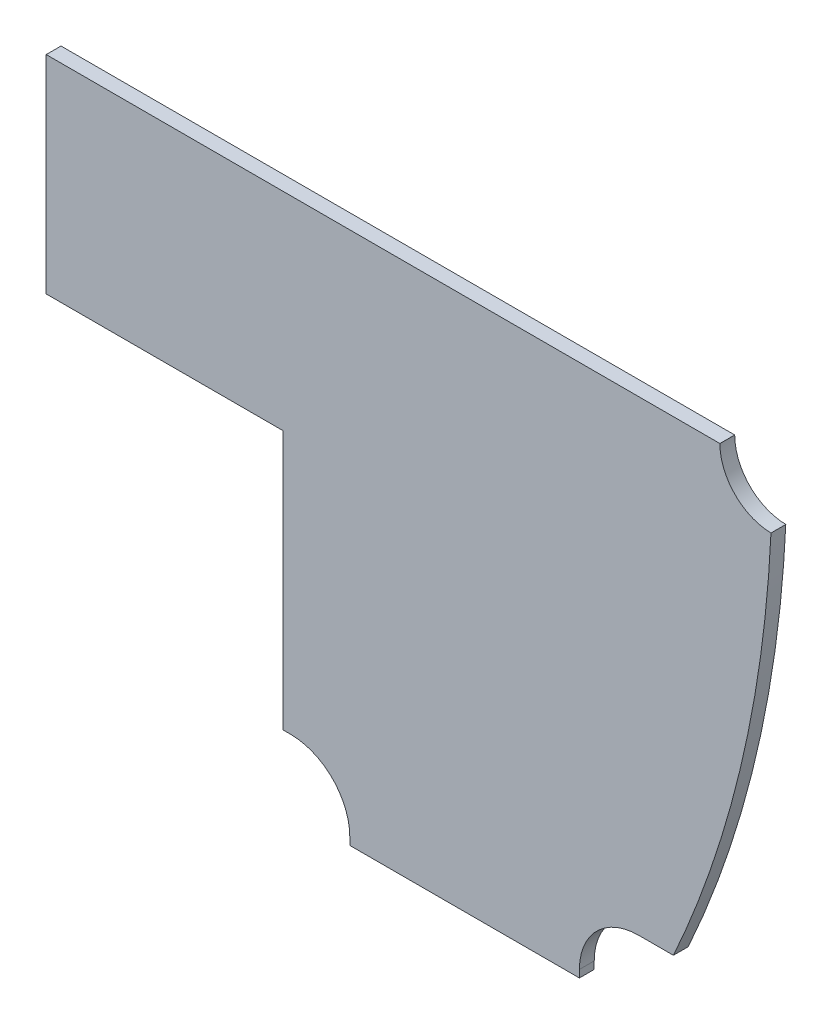
from build123d import *

# Parameters (mm, degrees)
EXTRUDE_1_DEPTH = 1


with BuildPart() as part:
    # 草图1 → 凸台-拉伸1 (new body)
    with BuildSketch(Plane.XY):
        with BuildLine():
            Line((-61, -32), (-60.5, -32))
            ThreePointArc((-60.5, -32), (-57.671572875, -33.171572875), (-56.5, -36))
            Line((-56.5, -36), (-56.5, -36.5))
            Line((-56.5, -36.5), (-40.994977349, -36.5))
            Line((-40.994977349, -36.5), (-40.994977349, -36))
            ThreePointArc((-40.994977349, -36), (-39.823404474, -33.171572875), (-36.994977349, -32))
            Line((-36.994977349, -32), (-34.648063919, -32))
            add(Edge.make_bspline(
                [(-34.648063919, -32), (-33.649188035, -29.801521516), (-32.763169649, -27.559357), (-31.602588747, -24.130906164), (-31.243984455, -22.977553874), (-30.584883688, -20.657911853), (-30.284019718, -19.490574743), (-29.738521235, -17.141167899), (-29.493713152, -15.957957975), (-29.060766213, -13.585894928), (-28.872271639, -12.396416473), (-28.388058555, -8.817968759), (-28.173290485, -6.419025656), (-28.058899629, -4.007718216)],
                knots=[0, 0, 0, 0, 0.25, 0.25, 0.375, 0.375, 0.5, 0.5, 0.625, 0.625, 0.75, 0.75, 1, 1, 1, 1], degree=3))
            ThreePointArc((-28.058899629, -4.007718216), (-30.500861029, -2.964930185), (-31.508087081, -0.508087081))
            Line((-31.508087081, -0.508087081), (-31.508087081, -0.5))
            Line((-31.508087081, -0.5), (-77, -0.5))
            Line((-77, -0.5), (-77, -14.5))
            Line((-77, -14.5), (-61, -14.5))
            Line((-61, -14.5), (-61, -32))
        make_face()
    extrude(amount=EXTRUDE_1_DEPTH)


solid = part.part
